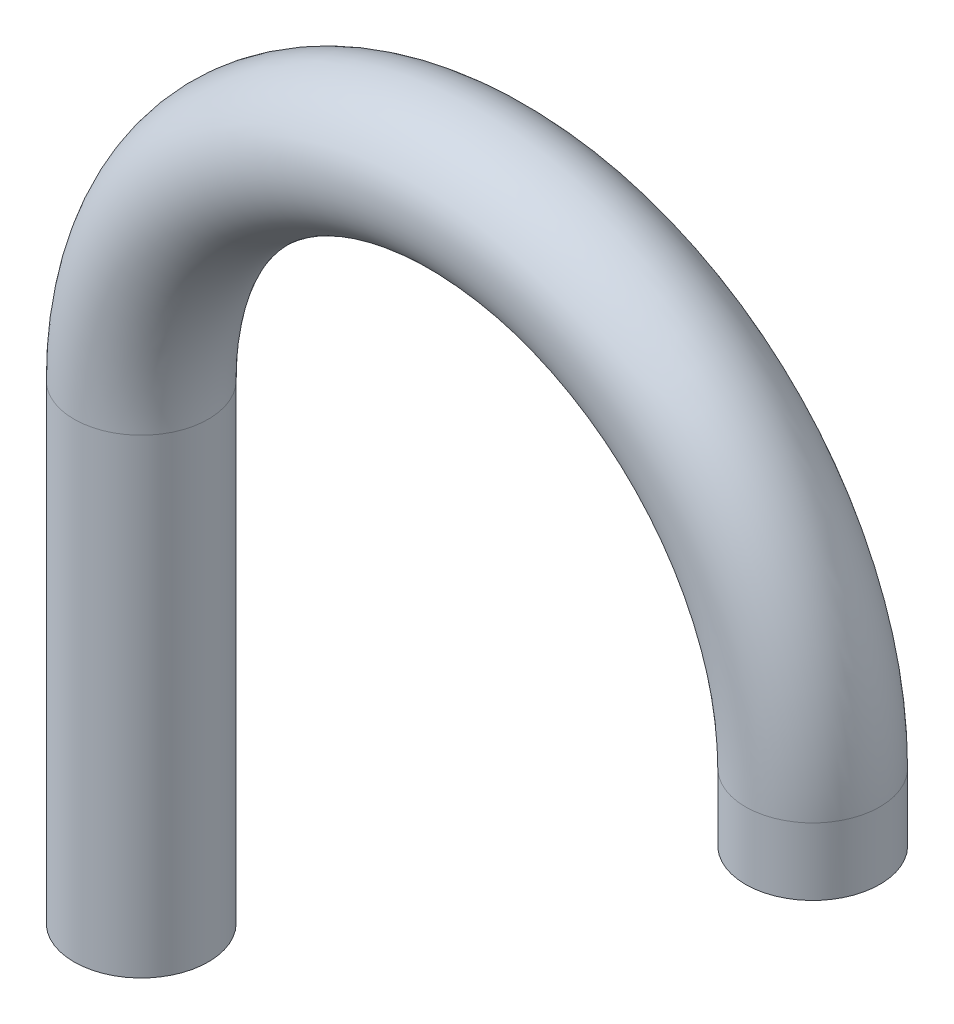
from build123d import *

# Parameters (mm, degrees)
SKETCH2_R = 1


with BuildPart() as part:
    # Sweep1: sweep along a path in Sketch1
    with BuildLine(Plane.XY) as sweep1_path:
        Line((-5, -7), (-5, 0))
        ThreePointArc((-5, 0), (0, 5), (5, 0))
        Line((5, 0), (5, -1))
    # Sketch2 → Sweep1 (sweep)
    with BuildSketch(Plane(origin=(0, -7, 0), x_dir=(1, 0, 0), z_dir=(0, 1, 0))):
        with Locations((-5, 0)):
            Circle(SKETCH2_R)
    sweep(path=sweep1_path.line)


solid = part.part
